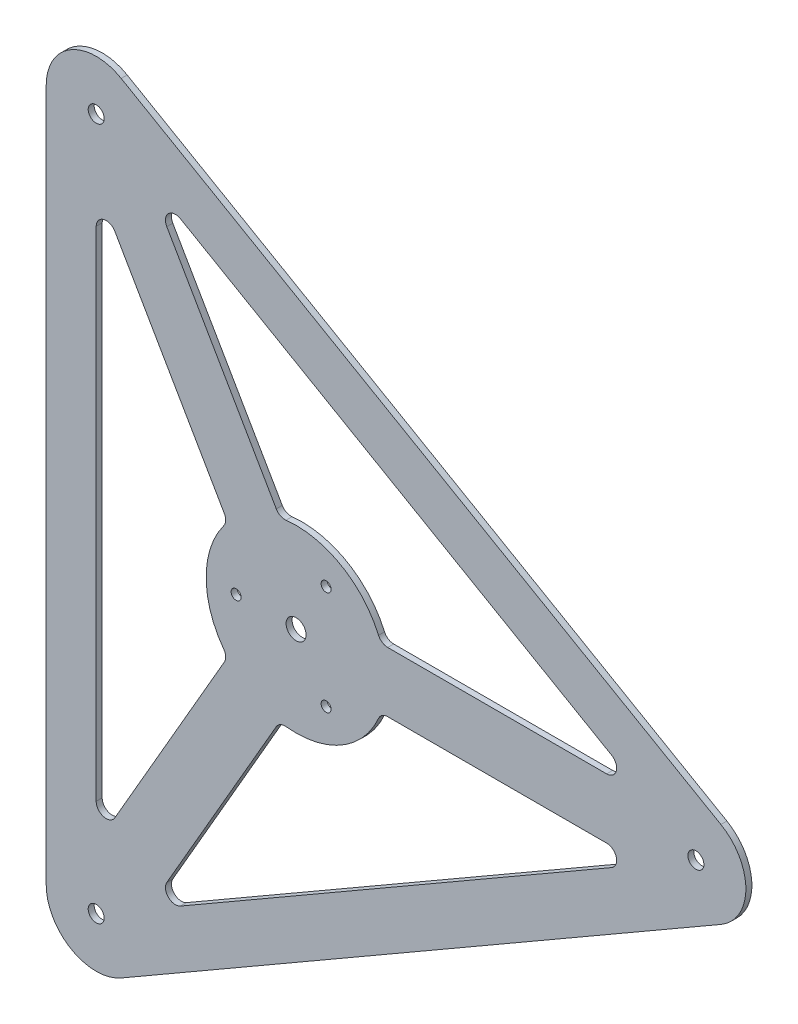
from build123d import *

# Parameters (mm, degrees)
BOARD_DEPTH  = 0.6
CUT_DEPTH    = 60.97307864
HOLESSKE_R   = 0.5
HOLESSKE_R_2 = 1
HOLES_DEPTH  = 60.97307864
HOLES2SKE_R  = 0.8
HOLES2_DEPTH = 60.97307864


with BuildPart() as part:
    # BoardSke → Board (new body)
    with BuildSketch(Plane.XY):
        with BuildLine():
            Line((42.5, 4.330127019), (-17.5, 38.97114317))
            ThreePointArc((-17.5, 38.97114317), (-22.5, 38.97114317), (-25, 34.641016151))
            Line((-25, 34.641016151), (-25, -34.641016151))
            ThreePointArc((-25, -34.641016151), (-22.5, -38.97114317), (-17.5, -38.97114317))
            Line((-17.5, -38.97114317), (42.5, -4.330127019))
            ThreePointArc((42.5, -4.330127019), (45, 0), (42.5, 4.330127019))
        make_face()
    extrude(amount=BOARD_DEPTH)

    # CutSke → Cut (cut, through all)
    with BuildSketch(Plane.XY.offset(0.6)):
        with BuildLine():
            Line((31.07179677, 3), (9.16515139, 3))
            ThreePointArc((9.16515139, 3), (8.617428832, 3.163339973), (8.248636251, 3.6))
            ThreePointArc((8.248636251, 3.6), (4.5, 7.794228634), (-1.006626672, 8.94352854))
            ThreePointArc((-1.006626672, 8.94352854), (-1.569181638, 9.044582271), (-1.984499484, 9.437253933))
            Line((-1.984499484, 9.437253933), (-12.937822174, 28.408965344))
            ThreePointArc((-12.937822174, 28.408965344), (-12.778903551, 29.616072125), (-11.57179677, 29.774990748))
            Line((-11.57179677, 29.774990748), (31.57179677, 4.866025404))
            ThreePointArc((31.57179677, 4.866025404), (32.037722596, 3.741180955), (31.07179677, 3))
        make_face()
        with BuildLine():
            Line((31.07179677, -3), (9.16515139, -3))
            ThreePointArc((9.16515139, -3), (8.617428832, -3.163339973), (8.248636251, -3.6))
            ThreePointArc((8.248636251, -3.6), (4.5, -7.794228634), (-1.006626672, -8.94352854))
            ThreePointArc((-1.006626672, -8.94352854), (-1.569181638, -9.044582271), (-1.984499484, -9.437253933))
            Line((-1.984499484, -9.437253933), (-12.937822174, -28.408965344))
            ThreePointArc((-12.937822174, -28.408965344), (-12.778903551, -29.616072125), (-11.57179677, -29.774990748))
            Line((-11.57179677, -29.774990748), (31.57179677, -4.866025404))
            ThreePointArc((31.57179677, -4.866025404), (32.037722596, -3.741180955), (31.07179677, -3))
        make_face()
        with BuildLine():
            Line((-18.133974596, -25.408965344), (-7.180651906, -6.437253933))
            ThreePointArc((-7.180651906, -6.437253933), (-7.048247194, -5.881242297), (-7.242009579, -5.34352854))
            ThreePointArc((-7.242009579, -5.34352854), (-9, 0), (-7.242009579, 5.34352854))
            ThreePointArc((-7.242009579, 5.34352854), (-7.048247194, 5.881242297), (-7.180651906, 6.437253933))
            Line((-7.180651906, 6.437253933), (-18.133974596, 25.408965344))
            ThreePointArc((-18.133974596, 25.408965344), (-19.258819045, 25.87489117), (-20, 24.908965344))
            Line((-20, 24.908965344), (-20, -24.908965344))
            ThreePointArc((-20, -24.908965344), (-19.258819045, -25.87489117), (-18.133974596, -25.408965344))
        make_face()
    extrude(amount=-CUT_DEPTH, mode=Mode.SUBTRACT)

    # HolesSke → Holes (cut, through all)
    with BuildSketch(Plane.XY.offset(0.6)):
        with Locations((-6, 0)):
            Circle(HOLESSKE_R)
        with Locations((3, 5.196152423)):
            Circle(HOLESSKE_R)
        with Locations((3, -5.196152423)):
            Circle(HOLESSKE_R)
        Circle(HOLESSKE_R_2)
    extrude(amount=-HOLES_DEPTH, mode=Mode.SUBTRACT)

    # Holes2Ske → Holes2 (cut, through all)
    with BuildSketch(Plane.XY.offset(0.6)):
        with Locations((40, 0)):
            Circle(HOLES2SKE_R)
        with Locations((-20, -34.641016151)):
            Circle(HOLES2SKE_R)
        with Locations((-20, 34.641016151)):
            Circle(HOLES2SKE_R)
    extrude(amount=-HOLES2_DEPTH, mode=Mode.SUBTRACT)


solid = part.part
